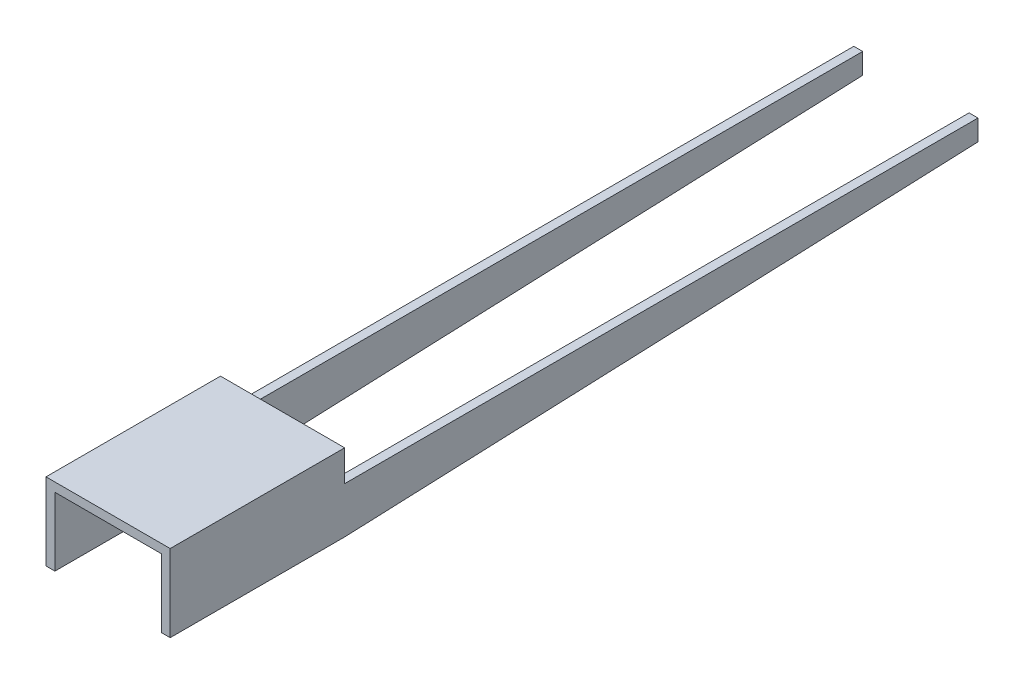
from build123d import *

# Parameters (mm, degrees)
BOSS_EXTRUDE1_DEPTH = 390.3
BOSS_EXTRUDE2_DEPTH = 4.3
SKETCH3_W           = 8.6
SKETCH3_H           = 70
CUT_EXTRUDE1_DEPTH  = 10
SKETCH4_W           = 230.803227125
SKETCH4_H           = 349.257793427
CUT_EXTRUDE2_DEPTH  = 15


with BuildPart() as part:
    # Sketch1 → Boss-Extrude1 (new body)
    with BuildSketch(Plane.XY):
        Polygon((-30, 0), (-25.7, 0), (-25.7, 20.7), (25.7, 20.7), (25.7, 0), (30, 0), (30, 25), (-30, 25), align=None)
    extrude(amount=BOSS_EXTRUDE1_DEPTH)

    # Sketch2 → Boss-Extrude2 (add)
    with BuildSketch(Plane(origin=(30, 0, 0), x_dir=(0, 0, -1), z_dir=(1, 0, 0))):
        Polygon((-306, -12.31), (0, 0), (-390.3, 0), (-390.3, -12.31), align=None)
    boss_extrude2 = extrude(amount=-BOSS_EXTRUDE2_DEPTH)

    # Mirror1: Boss-Extrude2 across plane
    add(boss_extrude2.mirror(Plane(origin=(0, 0, 0), x_dir=(0, 0, 1), z_dir=(1, 0, 0))))

    # Sketch3 → Cut-Extrude1 (cut)
    with BuildSketch(Plane(origin=(0, 25, 0), x_dir=(1, 0, 0), z_dir=(0, 1, 0))):
        with Locations((0, -35)):
            Rectangle(SKETCH3_W, SKETCH3_H)
    extrude(amount=-CUT_EXTRUDE1_DEPTH, mode=Mode.SUBTRACT)

    # Sketch4 → Cut-Extrude2 (cut)
    with BuildSketch(Plane(origin=(0, 25, 0), x_dir=(1, 0, 0), z_dir=(0, 1, 0))):
        with Locations((42.992725749, -131.371103286)):
            Rectangle(SKETCH4_W, SKETCH4_H)
    extrude(amount=-CUT_EXTRUDE2_DEPTH, mode=Mode.SUBTRACT)


solid = part.part
